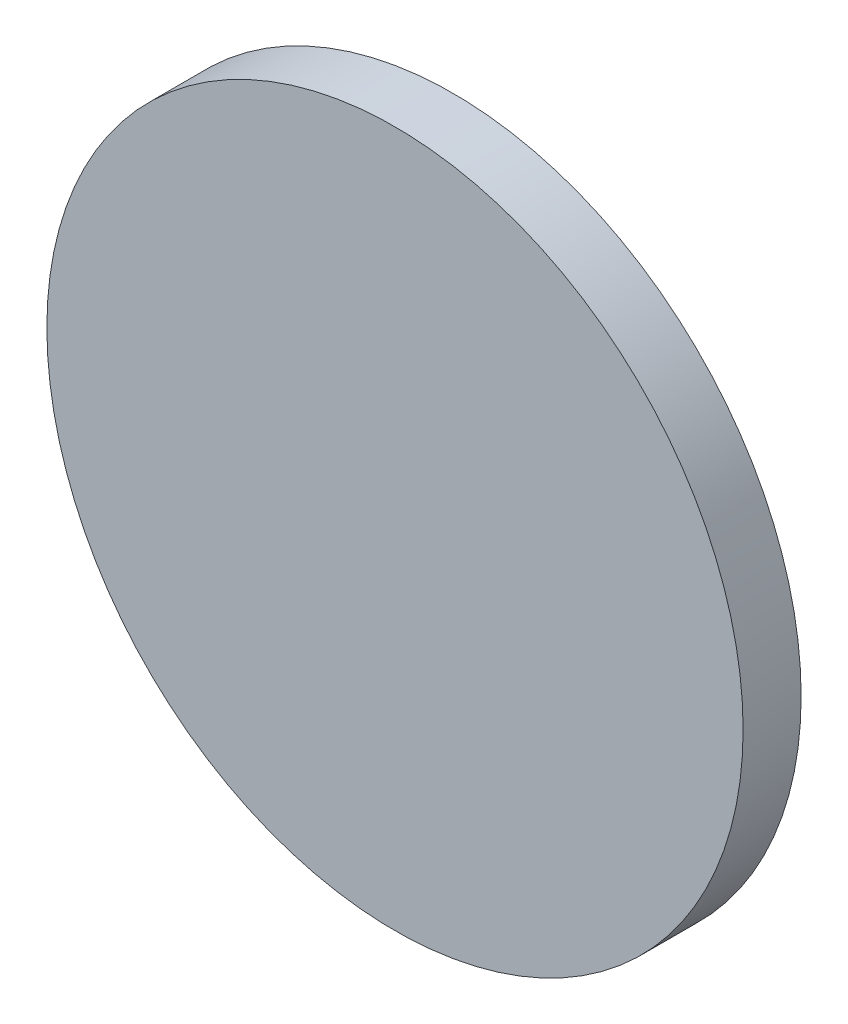
from build123d import *

# Parameters (mm, degrees)
SKETCH1_R           = 38.1
BOSS_EXTRUDE1_DEPTH = 6.35
SKETCH4_W           = 20.2
SKETCH4_H           = 40.04
CUT_EXTRUDE1_DEPTH  = 5.3


with BuildPart() as part:
    # Sketch1 → Boss-Extrude1 (new body)
    with BuildSketch(Plane.XY):
        Circle(SKETCH1_R)
    extrude(amount=BOSS_EXTRUDE1_DEPTH)

    # Sketch4 → Cut-Extrude1 (cut)
    with BuildSketch(Plane(origin=(0, 0, 0), x_dir=(-1, 0, 0), z_dir=(0, 0, -1))):
        with Locations((0, 10)):
            Rectangle(SKETCH4_W, SKETCH4_H)
    extrude(amount=-CUT_EXTRUDE1_DEPTH, mode=Mode.SUBTRACT)


solid = part.part
